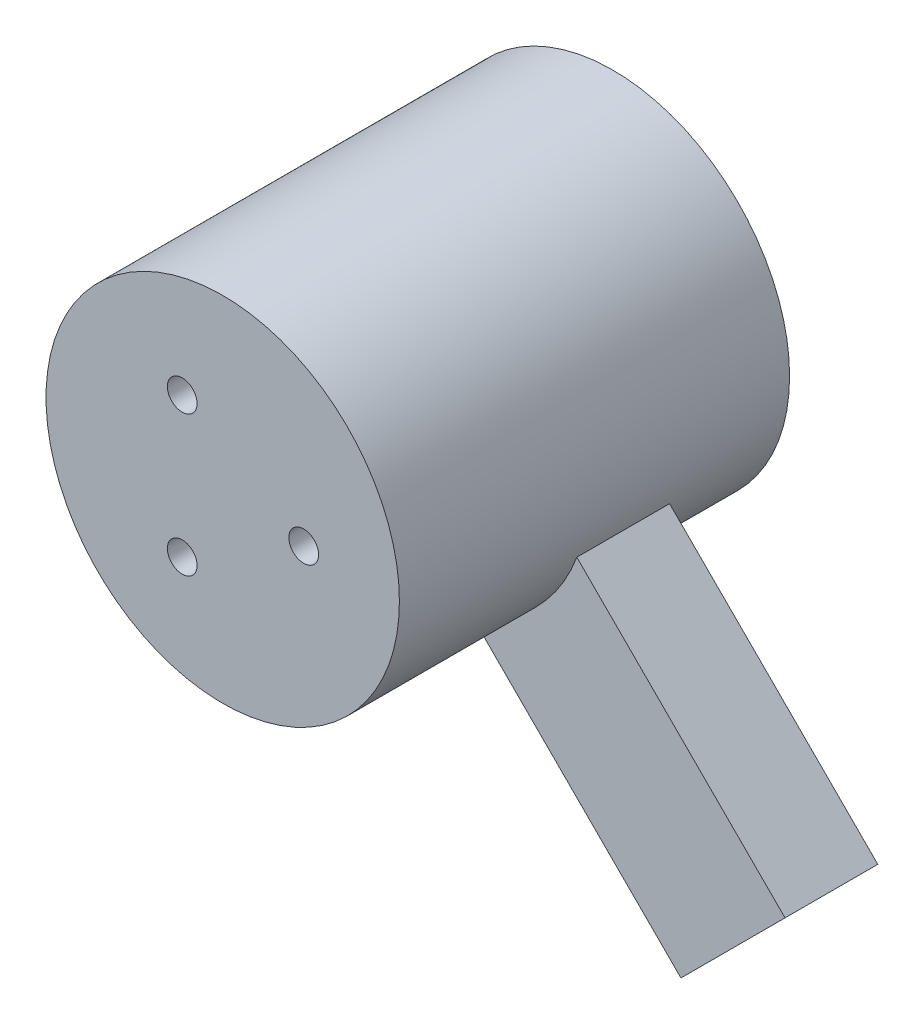
from build123d import *

# Parameters (mm, degrees)
SKETCH_1_R          = 12
SKETCH_1_R_2        = 1.5
EXTRUDE_1_DEPTH     = 28
SKETCH_2_R          = 20
EXTRUDE_2_DEPTH     = 11
EXTRUDE_START       = -7.4
EXTRUDE_3_DEPTH     = 6.3
SKETCH_4_R          = 20
SKETCH_4_R_2        = 12
CUT_EXTRUDE_1_DEPTH = 39
CUT_EXTRUDE_START   = -1.5
SKETCH_5_R          = 12
CUT_EXTRUDE_2_DEPTH = 1.5
SKETCH_6_R          = 1.01
CUT_EXTRUDE_3_DEPTH = 1.5


with BuildPart() as part:
    # 草图1 → 凸台-拉伸1 (new body)
    with BuildSketch(Plane.XY):
        Circle(SKETCH_1_R)
        with Locations((-8, 0)):
            Circle(SKETCH_1_R_2, mode=Mode.SUBTRACT)
        with Locations(Location((8, 0, 0), (0, 0, 180))):
            Circle(SKETCH_1_R_2, mode=Mode.SUBTRACT)
        with Locations((0, 8)):
            Circle(SKETCH_1_R_2, mode=Mode.SUBTRACT)
        with Locations(Location((0, -8, 0), (0, 0, 180))):
            Circle(SKETCH_1_R_2, mode=Mode.SUBTRACT)
    extrude(amount=EXTRUDE_1_DEPTH)

    # 草图2 → 凸台-拉伸2 (add)
    with BuildSketch(Plane.XY.offset(28)):
        Circle(SKETCH_2_R)
    extrude(amount=-EXTRUDE_2_DEPTH)

    # 草图3 → 凸台-拉伸3 (add)
    with BuildSketch(Plane(origin=(0, 0, 0), x_dir=(-1, 0, 0), z_dir=(0, 0, -1)).offset(EXTRUDE_START)):
        with BuildLine():
            ThreePointArc((-4.178090404, -11.249158216), (-8.485281374, -8.485281374), (-11.249158216, -4.178090404))
            Line((-11.249158216, -4.178090404), (-25.39129384, -18.320226028))
            Line((-25.39129384, -18.320226028), (-18.320226028, -25.39129384))
            Line((-18.320226028, -25.39129384), (-4.178090404, -11.249158216))
        make_face()
    extrude(amount=-EXTRUDE_3_DEPTH)

    # 草图4 → 切除-拉伸1 (cut)
    with BuildSketch(Plane(origin=(0, 0, 17), x_dir=(-1, 0, 0), z_dir=(0, 0, -1))):
        Circle(SKETCH_4_R)
        with Locations(Location((0, 0, 0), (0, 0, 180))):
            Circle(SKETCH_4_R_2, mode=Mode.SUBTRACT)
    extrude(amount=-CUT_EXTRUDE_1_DEPTH, mode=Mode.SUBTRACT)

    # 草图5 → 切除-拉伸2 (cut)
    with BuildSketch(Plane.XY.offset(28).offset(CUT_EXTRUDE_START)):
        Circle(SKETCH_5_R)
    extrude(amount=CUT_EXTRUDE_2_DEPTH, mode=Mode.SUBTRACT)

    # 草图6 → 切除-拉伸3 (cut)
    with BuildSketch(Plane.XY.offset(26.5)):
        with Locations((5.5, 0)):
            Circle(SKETCH_6_R)
        with Locations((-2.75, -4.763139721)):
            Circle(SKETCH_6_R)
        with Locations((-2.75, 4.763139721)):
            Circle(SKETCH_6_R)
    extrude(amount=-CUT_EXTRUDE_3_DEPTH, mode=Mode.SUBTRACT)


solid = part.part
